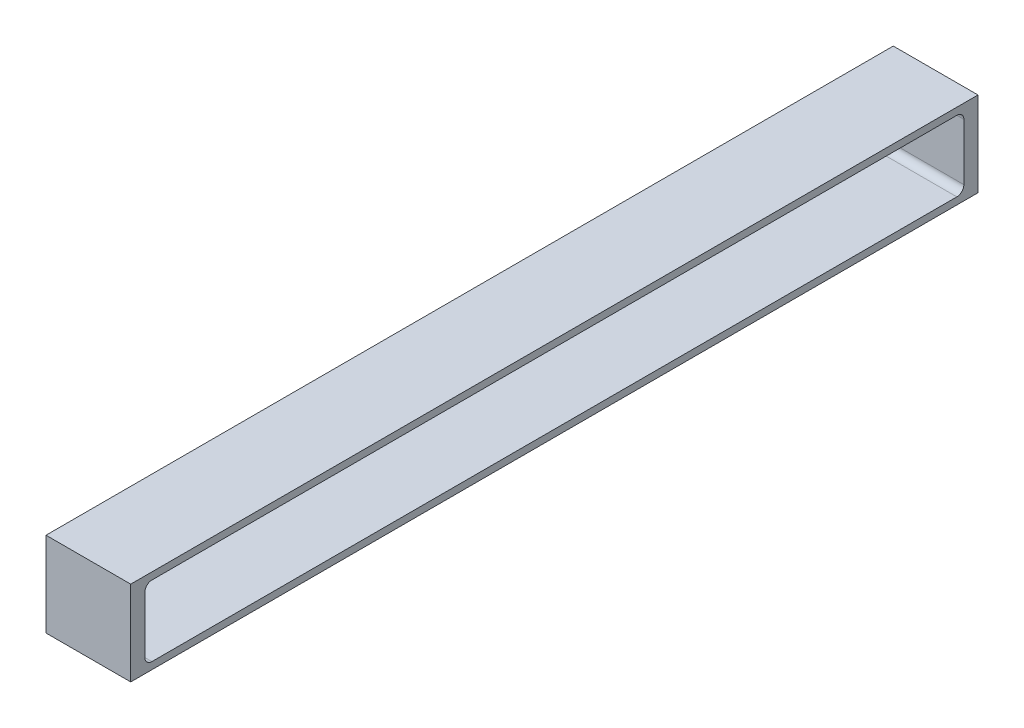
from build123d import *

# Parameters (mm, degrees)
SKETCH2_W           = 38.1
SKETCH2_H           = 38.1
BOSS_EXTRUDE1_DEPTH = 381
SKETCH3_W           = 368.3
SKETCH3_H           = 31.75
CUT_EXTRUDE1_DEPTH  = 33.3375
FILLET1_R           = 3.175


with BuildPart() as part:
    # Sketch2 → Boss-Extrude1 (new body)
    with BuildSketch(Plane.XY):
        with Locations((19.05, 19.05)):
            Rectangle(SKETCH2_W, SKETCH2_H)
    extrude(amount=BOSS_EXTRUDE1_DEPTH)

    # Sketch3 → Cut-Extrude1 (cut)
    with BuildSketch(Plane(origin=(38.1, 0, 0), x_dir=(0, 0, -1), z_dir=(1, 0, 0))):
        with Locations((-190.5, 19.05)):
            Rectangle(SKETCH3_W, SKETCH3_H)
    extrude(amount=-CUT_EXTRUDE1_DEPTH, mode=Mode.SUBTRACT)

    # Fillet1
    fillet1_edges = [part.edges().sort_by_distance(p)[0] for p in [
        (21.43125, 3.175, 374.65),
        (21.43125, 34.925, 374.65),
        (21.43125, 34.925, 6.35),
        (21.43125, 3.175, 6.35),
    ]]
    fillet(fillet1_edges, radius=FILLET1_R)


solid = part.part
